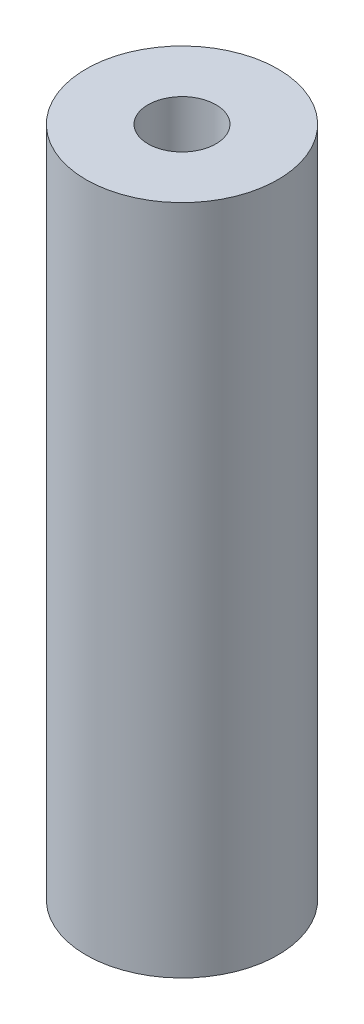
from build123d import *

# Parameters (mm, degrees)
SKETCH1_R             = 6.35
BOSS_EXTRUDE1_DEPTH   = 44.45
F_8_CLEARANCE_HOLE1_D = 4.4958


with BuildPart() as part:
    # Sketch1 → Boss-Extrude1 (new body)
    with BuildSketch(Plane(origin=(0, 0, 0), x_dir=(1, 0, 0), z_dir=(0, 1, 0))):
        with Locations(Location((0, 0, 0), (0, 0, 270))):
            Circle(SKETCH1_R)
    extrude(amount=BOSS_EXTRUDE1_DEPTH)

    # #8 Clearance Hole1 (through all)
    with Locations(Plane(origin=(0, 44.45, 0), x_dir=(1, 0, 0), z_dir=(0, 1, 0))):
        with Locations((0, 0)):
            Hole(F_8_CLEARANCE_HOLE1_D / 2)


solid = part.part
